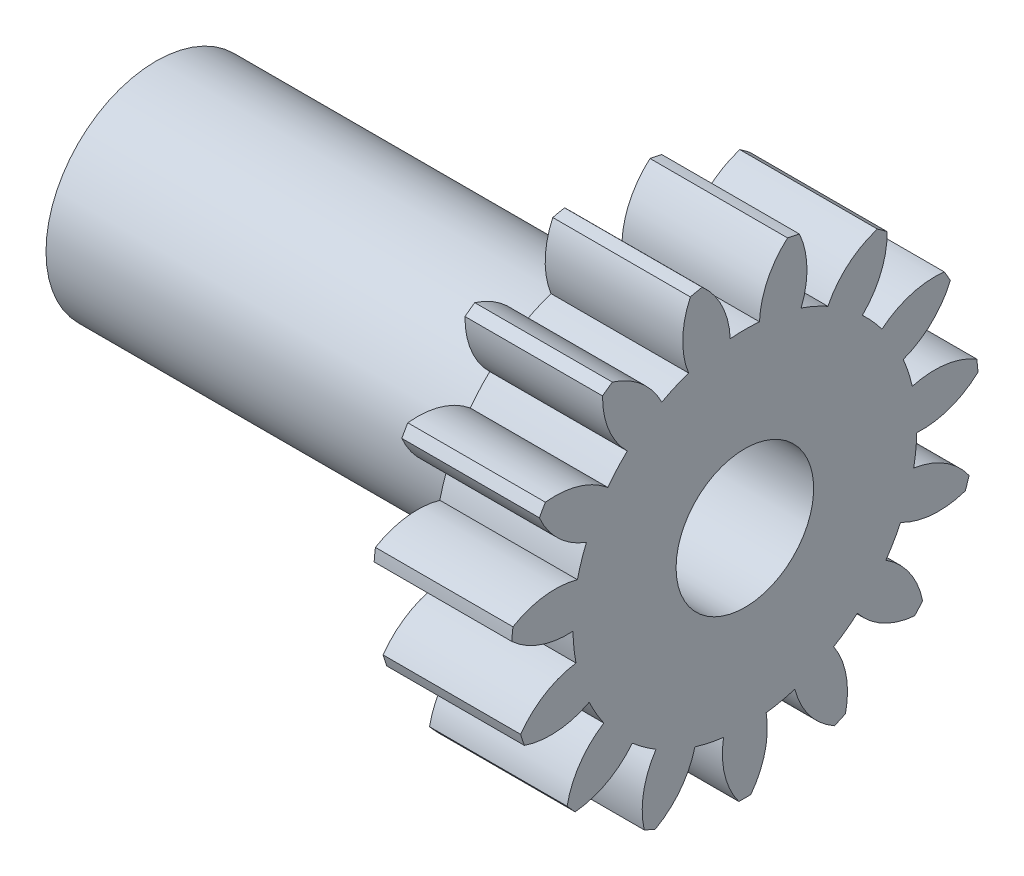
from build123d import *

# Parameters (mm, degrees)
BASPROSKE_W      = 5
BASPROSKE_H      = 8.5
TOOTHCUT_DEPTH   = 14.019216566
TEETHCUTS_COUNT  = 15
TEETHCUTS_ANGLE  = 336
HUBNEAONESKE_R   = 4
HUBNEARONE_DEPTH = 16.4000508
BORSKE_R         = 2.5
BORE_DEPTH       = 21.4000508


with BuildPart() as part:
    # BasProSke → Base-Revolve (revolve)
    with BuildSketch(Plane(origin=(0, 0, 0), x_dir=(1, 0, 0), z_dir=(0, 1, 0)), mode=Mode.PRIVATE) as base_revolve_sk:
        with Locations((2.5, 4.25)):
            Rectangle(BASPROSKE_W, BASPROSKE_H)
    revolve(base_revolve_sk.sketch.rotate(Axis((-10, 0, 0), (1, 0, 0)), 180), axis=Axis((-10, 0, 0), (1, 0, 0)))

    # TooCutSke → ToothCut (cut, through all)
    with BuildSketch(Plane(origin=(0, 0, 0), x_dir=(0, 0, -1), z_dir=(1, 0, 0))):
        with BuildLine():
            ThreePointArc((0.531576138, 6.226349477), (0, 6.249), (-0.531576138, 6.226349477))
            ThreePointArc((-0.531576138, 6.226349477), (-0.830301624, 7.411024729), (-1.576608494, 8.378350125))
            ThreePointArc((-1.576608494, 8.378350125), (0, 8.5254), (1.576608494, 8.378350125))
            ThreePointArc((1.576608494, 8.378350125), (0.830301624, 7.411024729), (0.531576138, 6.226349477))
        make_face()
    toothcut = extrude(amount=TOOTHCUT_DEPTH, mode=Mode.SUBTRACT)

    # TeethCuts: ToothCut ×15 about axis
    teethcuts_axis = Axis((-10, 0, 0), (1, 0, 0))
    for i in range(1, TEETHCUTS_COUNT):
        add(toothcut.rotate(teethcuts_axis, i * TEETHCUTS_ANGLE / (TEETHCUTS_COUNT - 1)), mode=Mode.SUBTRACT)

    # HubNeaOneSke → HubNearOne (add)
    with BuildSketch(Plane.ZY):
        with Locations(Location((0, 0, 0), (0, 0, 180))):
            Circle(HUBNEAONESKE_R)
    extrude(amount=HUBNEARONE_DEPTH)

    # BorSke → Bore (cut, symmetric)
    with BuildSketch(Plane(origin=(0, 0, 0), x_dir=(0, 0, -1), z_dir=(1, 0, 0))):
        with Locations(Location((0, 0, 0), (0, 0, 180))):
            Circle(BORSKE_R)
    extrude(amount=BORE_DEPTH, both=True, mode=Mode.SUBTRACT)


solid = part.part
